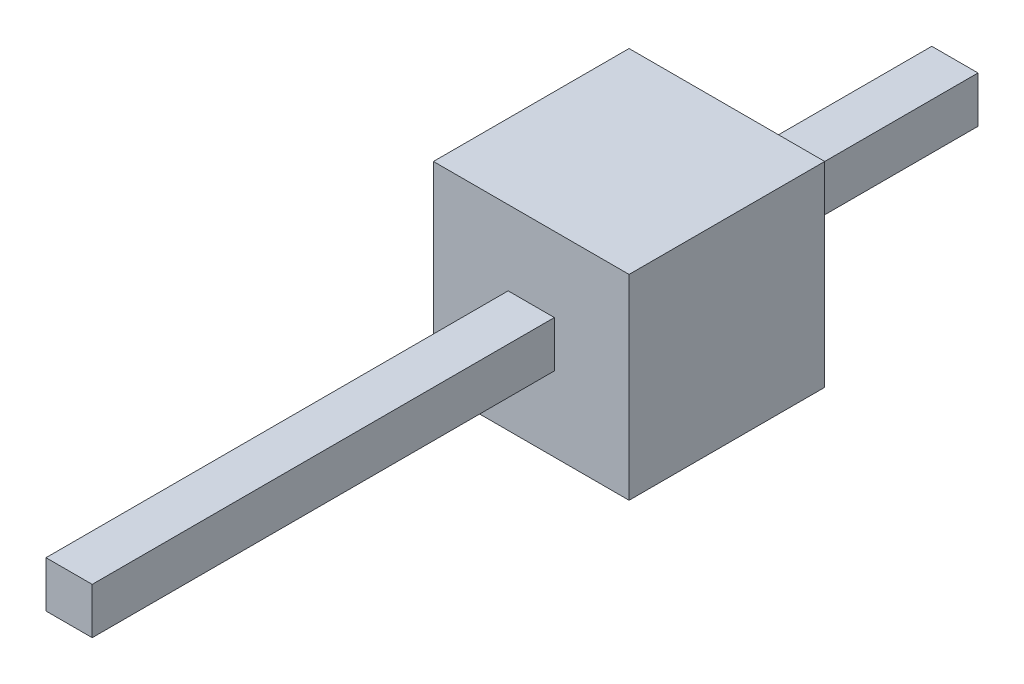
from build123d import *

# Parameters (mm, degrees)
CROQUIS1_W                   = 2.54
CROQUIS1_H                   = 2.54
CROQUIS1_W_2                 = 0.6
CROQUIS1_H_2                 = 0.6
SALIENTE_EXTRUIR1_DEPTH      = 2.54
SALIENTE_EXTRUIR2_DEPTH      = 6
SALIENTE_EXTRUIR2_DEPTH_BACK = 5.5
CROQUIS2_W                   = 0.6
CROQUIS2_H                   = 0.6


with BuildPart() as part:
    # Croquis1 → Saliente-Extruir1 (new body)
    with BuildSketch(Plane.XY):
        Rectangle(CROQUIS1_W, CROQUIS1_H)
        Rectangle(CROQUIS1_W_2, CROQUIS1_H_2, mode=Mode.SUBTRACT)
    extrude(amount=SALIENTE_EXTRUIR1_DEPTH)

    # Croquis2 → Saliente-Extruir2 (add, two sides: drawn at the far end of the back side and taken through both)
    with BuildSketch(Plane.XY.offset(2.54).offset(-SALIENTE_EXTRUIR2_DEPTH_BACK)):
        Rectangle(CROQUIS2_W, CROQUIS2_H)
    extrude(amount=SALIENTE_EXTRUIR2_DEPTH + SALIENTE_EXTRUIR2_DEPTH_BACK)


solid = part.part
